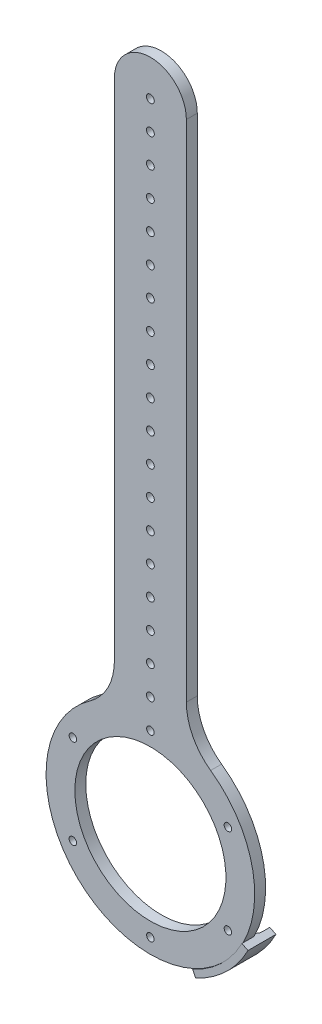
from build123d import *

# Parameters (mm, degrees)
BOSS_EXTRUDE1_DEPTH                             = 4.826
SKETCH2_R                                       = 33.3375
CUT_EXTRUDE1_DEPTH                              = 347.01033464659696
FILLET1_R                                       = 25.400000000000002
LPATTERN2_COUNT                                 = 19
LPATTERN2_PITCH                                 = 12.7
CSK_FOR_M3_FLAT_HEAD_MACHINE_SCREW1_D           = 3.3
CSK_FOR_M3_FLAT_HEAD_MACHINE_SCREW1_CSINK_D     = 6.35
CSK_FOR_M3_FLAT_HEAD_MACHINE_SCREW1_CSINK_ANGLE = 90
CIRPATTERN1_COUNT                               = 6
BOSS_EXTRUDE2_DEPTH                             = 7
BOSS_EXTRUDE2_DEPTH_BACK                        = 5.326


with BuildPart() as part:
    # Sketch1 → Boss-Extrude1 (new body)
    with BuildSketch(Plane.XY):
        with BuildLine():
            Line((15.875, 89.25133784449143), (15.875, 327.02500000000003))
            ThreePointArc((15.875, 327.02500000000003), (3.68e-15, 342.90000000000003), (-15.875, 327.02500000000003))
            Line((-15.875, 327.02500000000003), (-15.875, 89.25133784449143))
            ThreePointArc((-15.875, 89.25133784449143), (-8.46e-15, 7.11e-15), (15.875, 89.25133784449143))
        make_face()
    extrude(amount=BOSS_EXTRUDE1_DEPTH)

    # Sketch2 → Cut-Extrude1 (cut, through all)
    with BuildSketch(Plane.XY.offset(4.826)):
        with Locations((0, 46.0375)):
            Circle(SKETCH2_R)
    extrude(amount=-CUT_EXTRUDE1_DEPTH, mode=Mode.SUBTRACT)

    # Fillet1
    fillet1_edges = [part.edges().sort_by_distance(p)[0] for p in [
        (15.875000000000002, 89.25133784449145, 2.413),
        (-15.874999999999998, 89.25133784449142, 2.413),
    ]]
    fillet(fillet1_edges, radius=FILLET1_R)

    # Sketch4 → #8-32 Tapped Hole1 (revolve, cut)
    with BuildSketch(Plane(origin=(2.71e-15, 327.02500000000003, 4.826), x_dir=(0, -1, 0), z_dir=(1, 0, 0))):
        Polygon((0, 0), (-2.87e-15, 11.705806461184395), (1.7271999999999874, 10.667999999999997), (1.7271999999999894, -1.34e-15), align=None)
    f_8_32_tapped_hole1 = revolve(axis=Axis((2.71e-15, 327.02500000000003, 11.175999999999991), (0, 0, -1)), mode=Mode.SUBTRACT)

    # LPattern2: #8-32 Tapped Hole1 ×19
    with Locations(*[(0, -i * LPATTERN2_PITCH, 0) for i in range(1, LPATTERN2_COUNT)]):
        add(f_8_32_tapped_hole1, mode=Mode.SUBTRACT)

    # CSK for M3 Flat Head Machine Screw1 (through all)
    with Locations(Plane(origin=(0, 0, 0), x_dir=(-1, 0, 0), z_dir=(0, 0, -1))):
        with Locations((0, 85.537499994)):
            csk_for_m3_flat_head_machine_screw1 = CounterSinkHole(CSK_FOR_M3_FLAT_HEAD_MACHINE_SCREW1_D / 2, CSK_FOR_M3_FLAT_HEAD_MACHINE_SCREW1_CSINK_D / 2, counter_sink_angle=CSK_FOR_M3_FLAT_HEAD_MACHINE_SCREW1_CSINK_ANGLE)

    # CirPattern1: CSK for M3 Flat Head Machine Screw1 ×6 about axis
    cirpattern1_axis = Axis((0, 46.0375, 4.826), (0, 0, -1))
    for i in range(1, CIRPATTERN1_COUNT):
        add(csk_for_m3_flat_head_machine_screw1.rotate(cirpattern1_axis, i * 360 / CIRPATTERN1_COUNT), mode=Mode.SUBTRACT)

    # Sketch10 → Boss-Extrude2 (add, two sides: drawn at the far end of the back side and taken through both)
    with BuildSketch(Plane(origin=(0, 0, 0), x_dir=(-1, 0, 0), z_dir=(0, 0, -1)).offset(-BOSS_EXTRUDE2_DEPTH_BACK)):
        with BuildLine():
            Line((43.56363224338846, 23.52336328519776), (40.89851071944933, 24.900725714856833))
            ThreePointArc((40.89851071944933, 24.90072571485683), (31.779922400083834, 12.728523154491043), (19.192959693323502, 4.19157182938271))
            Line((19.192959693323495, 4.19157182938271), (20.443654867474322, 1.4647125405018753))
            ThreePointArc((20.443654867474315, 1.4647125405018642), (33.850837788631225, 10.557968051878447), (43.56363224338847, 23.52336328519776))
        make_face()
    extrude(amount=BOSS_EXTRUDE2_DEPTH + BOSS_EXTRUDE2_DEPTH_BACK)

    # Sweep2: sweep along a curve in space
    with BuildLine() as sweep2_path:
        ThreePointArc((-40.89851071944929, 24.900725714856783, 1.73e-15), (-31.779922400083795, 12.728523154491036, 9.2e-16), (-19.192959693323488, 4.191571829382735, 0))
    # Sketch12 → Sweep2 (sweep)
    with BuildSketch(Plane(origin=(-17.445500140285052, 8.001514022037082, 0), x_dir=(0, 0, -1), z_dir=(0.908953096293619, -0.41689839138361184, 0))):
        with BuildLine():
            Line((0, -4.191571829382516), (3.5, -4.191571829382516))
            ThreePointArc((3.5, -4.191571829382516), (1.4844355629253627, -3.6563095942631314), (0, -2.1915718293825166))
            Line((0, -2.1915718293825166), (0, -4.191571829382516))
        make_face()
    sweep(path=sweep2_path.line)


with BuildPart() as body_2:
    # Mirror3: mirrored copy
    add(part.part.mirror(Plane(origin=(-75, 0, 0), x_dir=(0, 0, 1), z_dir=(1, 0, 0))))


solid = body_2.part
